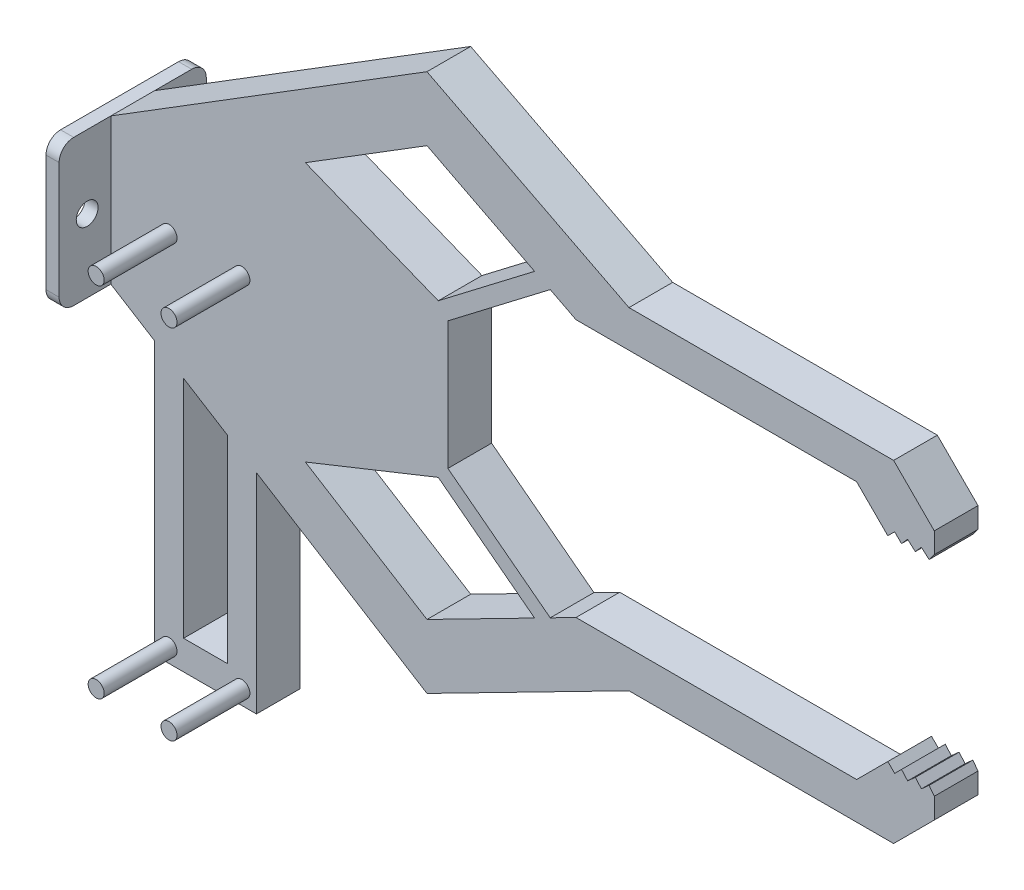
from build123d import *

# Parameters (mm, degrees)
EXTRUDE_1_DEPTH = 6
EXTRUDE_2_DEPTH = 6
EXTRUDE_3_DEPTH = 6
SKETCH_4_R      = 1.5
EXTRUDE_4_DEPTH = 1.8
SKETCH_5_R      = 1.1
EXTRUDE_5_DEPTH = 10
EXTRUDE_6_DEPTH = 6


with BuildPart() as part:
    # 草图1 → 凸台-拉伸1 (new body)
    with BuildSketch(Plane.XY):
        Polygon((0, 10), (0, -10), (43.391858736, -36.953542991), (71.115712236, -22.772903722), (107.439932669, -22.772903722), (113.022851841, -17.18998455), (113.022851841, -14.359848661), (105.70299447, -14.359848661), (102.364936039, -17.697907092), (63.844827478, -17.697907092), (43.391858736, -28.159518127), (15.650074222, -10.927267577), (15.650074222, 10.927267577), (43.391858736, 28.159518127), (63.844827478, 17.697907092), (102.364936039, 17.697907092), (105.70299447, 14.359848661), (113.022851841, 14.359848661), (113.022851841, 17.18998455), (107.439932669, 22.772903722), (71.115712236, 22.772903722), (43.391858736, 36.953542991), align=None)
    extrude(amount=EXTRUDE_1_DEPTH)

    # 草图2 → 凸台-拉伸2 (add)
    with BuildSketch(Plane.XY.offset(6)):
        Polygon((113.022851841, 14.359848661), (111.256497416, 14.359848661), (112.311790012, 13.419299654), align=None)
        Polygon((111.256497416, 14.359848661), (109.362923156, 14.359848661), (110.418215751, 13.419299654), align=None)
        Polygon((109.362923156, 14.359848661), (107.584092484, 14.359848661), (108.52464149, 13.419299654), align=None)
        Polygon((107.584092484, 14.359848661), (105.70299447, 14.359848661), (106.643543477, 13.419299654), align=None)
        Polygon((105.70299447, -14.359848661), (107.584092484, -14.359848661), (106.643543477, -13.419299654), align=None)
        Polygon((107.584092484, -14.359848661), (109.362923156, -14.359848661), (108.52464149, -13.419299654), align=None)
        Polygon((109.362923156, -14.359848661), (111.256497416, -14.359848661), (110.418215751, -13.419299654), align=None)
        Polygon((111.256497416, -14.359848661), (113.022851841, -14.359848661), (112.311790012, -13.419299654), align=None)
    extrude(amount=-EXTRUDE_2_DEPTH)

    # 草图3 → 凸台-拉伸3 (add)
    with BuildSketch(Plane.XY.offset(6)):
        Polygon((26.69644411, 17.788895872), (44.940516172, 10.497320184), (61.640798283, 23.261107226), (62.960793136, 21.534011156), (46.260511025, 8.770224115), (46.260511025, -8.770224115), (62.960793136, -21.534011156), (61.640798283, -23.261107226), (44.940516172, -10.497320184), (26.69644411, -17.788895872), (15.650074222, -10.927267577), (15.650074222, 10.927267577), align=None)
    extrude(amount=-EXTRUDE_3_DEPTH)

    # 草图4 → 凸台-拉伸4 (add)
    with BuildSketch(Plane.ZY):
        with BuildLine():
            Line((-5.1, -10), (11.1, -10))
            ThreePointArc((11.1, -10), (12.514213562, -9.414213562), (13.1, -8))
            Line((13.1, -8), (13.1, 8))
            ThreePointArc((13.1, 8), (12.514213562, 9.414213562), (11.1, 10))
            Line((11.1, 10), (-5.1, 10))
            ThreePointArc((-5.1, 10), (-6.514213562, 9.414213562), (-7.1, 8))
            Line((-7.1, 8), (-7.1, -8))
            ThreePointArc((-7.1, -8), (-6.514213562, -9.414213562), (-5.1, -10))
        make_face()
        with Locations(Location((9.25, 0, 0), (0, 0, 270))):
            Circle(SKETCH_4_R, mode=Mode.SUBTRACT)
        with Locations(Location((-3.25, 0, 0), (0, 0, 270))):
            Circle(SKETCH_4_R, mode=Mode.SUBTRACT)
    extrude(amount=EXTRUDE_4_DEPTH)

    # 草图5 → 凸台-拉伸5 (add)
    with BuildSketch(Plane.XY.offset(6)):
        with Locations(Location((17.984736969, 0, 0), (0, 0, 180))):
            Circle(SKETCH_5_R)
        with Locations(Location((7.984736969, 0, 0), (0, 0, 180))):
            Circle(SKETCH_5_R)
        with Locations((7.984736969, -49.1)):
            Circle(SKETCH_5_R)
        with Locations((17.984736969, -49.1)):
            Circle(SKETCH_5_R)
    extrude(amount=EXTRUDE_5_DEPTH)


with BuildPart() as extrude_5_piece_1:
    # of the separate pieces the step leaves, piece 1, a body of its own (extrude_5_pieces)
    add(part.part.solids().sort_by_distance((0, -10, -5.1))[0])



with BuildPart() as extrude_5_piece_2:
    # of the separate pieces the step leaves, piece 2, a body of its own (extrude_5_pieces)
    add(part.part.solids().sort_by_distance((9.084736969, -49.1, 6))[0])


with BuildPart() as extrude_5_piece_3:
    # of the separate pieces the step leaves, piece 3, a body of its own (extrude_5_pieces)
    add(part.part.solids().sort_by_distance((19.084736969, -49.1, 6))[0])


with BuildPart() as extrude_5_piece_1_1:
    add(extrude_5_piece_1.part)

    add(extrude_5_piece_2.part)  # 凸台-拉伸6 merges 凸台-拉伸5 piece 2

    add(extrude_5_piece_3.part)  # 凸台-拉伸6 merges 凸台-拉伸5 piece 3
    # 草图6 → 凸台-拉伸6 (add)
    with BuildSketch(Plane(origin=(0, 0, 6), x_dir=(-1, 0, 0), z_dir=(0, 0, -1))):
        Polygon((-15.984736969, -19.929173528), (-19.984736969, -22.413837129), (-19.984736969, -51.1), (-5.984736969, -51.1), (-5.984736969, -13.717514526), (-9.984736969, -16.202178127), (-9.984736969, -47.1), (-15.984736969, -47.1), align=None)
    extrude(amount=EXTRUDE_6_DEPTH)


solid = extrude_5_piece_1_1.part
